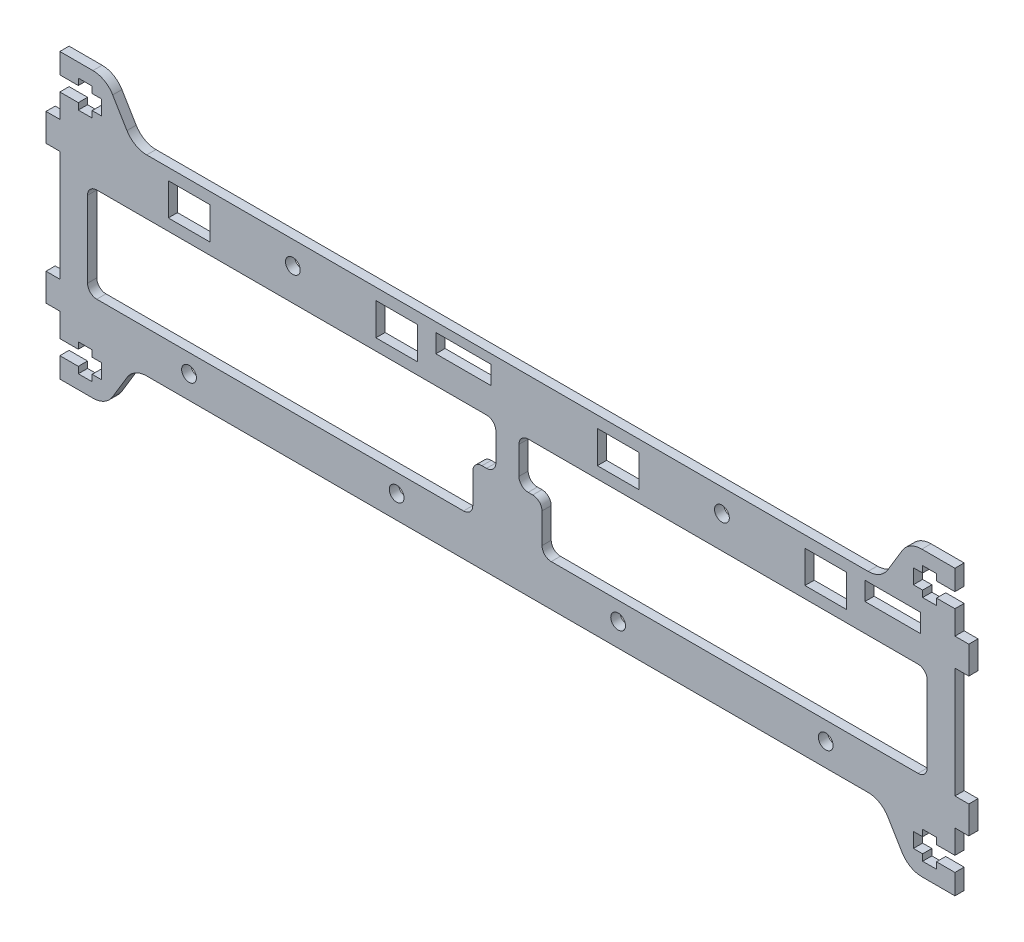
from build123d import *

# Parameters (mm, degrees)
SKETCH_1_R          = 1.6
SKETCH_1_W          = 83.5
SKETCH_1_H          = 20.5
EXTRUDE_1_DEPTH     = 2
SKETCH_3_W          = 5
SKETCH_3_H          = 10
CUT_EXTRUDE_2_DEPTH = 101.127730924
SKETCH_4_W          = 9
SKETCH_4_H          = 7
SKETCH_4_W_2        = 23
SKETCH_4_H_2        = 5.5
SKETCH_4_W_3        = 38
CUT_EXTRUDE_3_DEPTH = 101.127730924
SKETCH_5_W          = 12
SKETCH_5_H          = 4
CUT_EXTRUDE_4_DEPTH = 101.127730924
FILLET_8_R          = 2
FILLET_9_R          = 2
SKETCH_7_W          = 10
SKETCH_7_H          = 10
EXTRUDE_3_DEPTH     = 2
SKETCH_9_W          = 162.568913239
SKETCH_9_H          = 21.283892233
CUT_EXTRUDE_5_DEPTH = 103.240219581
SKETCH_8_W          = 3
SKETCH_8_H          = 6
EXTRUDE_4_DEPTH     = 2
CUT_EXTRUDE_6_DEPTH = 106.090734606
FILLET_10_R         = 5


with BuildPart() as part:
    # 草图1 → 凸台-拉伸1 (new body)
    with BuildSketch(Plane.XY):
        Polygon((64, -19.25), (29, -19.25), (29, -24.75), (-29, -24.75), (-29, -19.25), (-64, -19.25), (-64, -24.75), (-97, -24.75), (-97, 22.25), (97, 22.25), (97, -24.75), (64, -24.75), align=None)
        with Locations((-46.5, 17.25)):
            Circle(SKETCH_1_R, mode=Mode.SUBTRACT)
        with Locations((-69, -14.25)):
            Circle(SKETCH_1_R, mode=Mode.SUBTRACT)
        with Locations((-24, -14.25)):
            Circle(SKETCH_1_R, mode=Mode.SUBTRACT)
        with Locations(Location((69, -14.25, 0), (0, 0, 180))):
            Circle(SKETCH_1_R, mode=Mode.SUBTRACT)
        with Locations(Location((46.5, 17.25, 0), (0, 0, 180))):
            Circle(SKETCH_1_R, mode=Mode.SUBTRACT)
        with Locations(Location((24, -14.25, 0), (0, 0, 180))):
            Circle(SKETCH_1_R, mode=Mode.SUBTRACT)
        with Locations((-69, -21.75)):
            Circle(SKETCH_1_R, mode=Mode.SUBTRACT)
        with Locations((-24, -21.75)):
            Circle(SKETCH_1_R, mode=Mode.SUBTRACT)
        with Locations((24, -21.75)):
            Circle(SKETCH_1_R, mode=Mode.SUBTRACT)
        with Locations((69, -21.75)):
            Circle(SKETCH_1_R, mode=Mode.SUBTRACT)
        with Locations((-49.25, 0)):
            Rectangle(SKETCH_1_W, SKETCH_1_H, mode=Mode.SUBTRACT)
        with Locations((49.25, 0)):
            Rectangle(SKETCH_1_W, SKETCH_1_H, mode=Mode.SUBTRACT)
    extrude(amount=EXTRUDE_1_DEPTH)

    # 草图3 → 切除-拉伸2 (cut, through all)
    with BuildSketch(Plane.XY.offset(2)):
        with Locations((-5, 5.25)):
            Rectangle(SKETCH_3_W, SKETCH_3_H)
        with Locations((5, 5.25)):
            Rectangle(SKETCH_3_W, SKETCH_3_H)
    extrude(amount=-CUT_EXTRUDE_2_DEPTH, mode=Mode.SUBTRACT)

    # 草图4 → 切除-拉伸3 (cut, through all)
    with BuildSketch(Plane(origin=(0, 0, 0), x_dir=(-1, 0, 0), z_dir=(0, 0, -1))):
        with Locations((-69, 16.25)):
            Rectangle(SKETCH_4_W, SKETCH_4_H)
        with Locations((-24, 16.25)):
            Rectangle(SKETCH_4_W, SKETCH_4_H)
        with Locations((24, 16.25)):
            Rectangle(SKETCH_4_W, SKETCH_4_H)
        with Locations((69, 16.25)):
            Rectangle(SKETCH_4_W, SKETCH_4_H)
        with Locations((-85.5, -22)):
            Rectangle(SKETCH_4_W_2, SKETCH_4_H_2)
        with Locations((85.5, -22)):
            Rectangle(SKETCH_4_W_2, SKETCH_4_H_2)
        with Locations((0, -22)):
            Rectangle(SKETCH_4_W_3, SKETCH_4_H_2)
    extrude(amount=-CUT_EXTRUDE_3_DEPTH, mode=Mode.SUBTRACT)

    # 草图5 → 切除-拉伸4 (cut, through all)
    with BuildSketch(Plane(origin=(0, 0, 0), x_dir=(-1, 0, 0), z_dir=(0, 0, -1))):
        with Locations((-83.5, 18.25)):
            Rectangle(SKETCH_5_W, SKETCH_5_H)
        with Locations((9.5, 18.25)):
            Rectangle(SKETCH_5_W, SKETCH_5_H)
    extrude(amount=-CUT_EXTRUDE_4_DEPTH, mode=Mode.SUBTRACT)

    # 圆角8
    fillet_8_edges = [part.edges().sort_by_distance(p)[0] for p in [
        (-7.5, 0.25, 1),
        (-2.5, 10.25, 1),
        (-2.5, 0.25, 1),
        (7.5, 0.25, 1),
        (2.5, 0.25, 1),
        (2.5, 10.25, 1),
        (-91, 10.25, 1),
        (-91, -10.25, 1),
        (-7.5, -10.25, 1),
        (7.5, -10.25, 1),
        (91, -10.25, 1),
        (91, 10.25, 1),
    ]]
    fillet(fillet_8_edges, radius=FILLET_8_R)

    # 圆角9
    fillet_9_edges = [part.edges().sort_by_distance(p)[0] for p in [
        (74, -19.25, 1),
        (74, -24.75, 1),
        (-74, -24.75, 1),
        (-74, -19.25, 1),
        (19, -24.75, 1),
        (19, -19.25, 1),
        (64, -24.75, 1),
        (-19, -19.25, 1),
        (-19, -24.75, 1),
        (64, -19.25, 1),
        (29, -19.25, 1),
        (29, -24.75, 1),
        (-29, -24.75, 1),
        (-29, -19.25, 1),
        (-64, -19.25, 1),
        (-64, -24.75, 1),
    ]]
    fillet(fillet_9_edges, radius=FILLET_9_R)

    # 草图7 → 凸台-拉伸3 (add)
    with BuildSketch(Plane(origin=(0, 0, 0), x_dir=(-1, 0, 0), z_dir=(0, 0, -1))):
        with Locations((-92, 27.25)):
            Rectangle(SKETCH_7_W, SKETCH_7_H)
        with Locations((-92, -24.25)):
            Rectangle(SKETCH_7_W, SKETCH_7_H)
        with Locations((92, 27.25)):
            Rectangle(SKETCH_7_W, SKETCH_7_H)
        with Locations((92, -24.25)):
            Rectangle(SKETCH_7_W, SKETCH_7_H)
    extrude(amount=-EXTRUDE_3_DEPTH)

    # 草图9 → 切除-拉伸5 (cut, through all)
    with BuildSketch(Plane(origin=(0, 0, 0), x_dir=(-1, 0, 0), z_dir=(0, 0, -1))):
        with Locations((0.619782194, -29.891946117)):
            Rectangle(SKETCH_9_W, SKETCH_9_H)
    extrude(amount=-CUT_EXTRUDE_5_DEPTH, mode=Mode.SUBTRACT)

    # 草图8 → 凸台-拉伸4 (add)
    with BuildSketch(Plane(origin=(0, 0, 0), x_dir=(-1, 0, 0), z_dir=(0, 0, -1))):
        Polygon((-87, 32.25), (-81, 22.25), (-87, 22.25), align=None)
        Polygon((87, 32.25), (81, 22.25), (87, 22.25), align=None)
        Polygon((-87, -29.25), (-81, -19.25), (-87, -19.25), align=None)
        Polygon((87, -29.25), (81, -19.25), (87, -19.25), align=None)
        with Locations((-98.5, 16.5)):
            Rectangle(SKETCH_8_W, SKETCH_8_H)
        with Locations((-98.5, -13.5)):
            Rectangle(SKETCH_8_W, SKETCH_8_H)
        with Locations((98.5, -13.5)):
            Rectangle(SKETCH_8_W, SKETCH_8_H)
        with Locations((98.5, 16.5)):
            Rectangle(SKETCH_8_W, SKETCH_8_H)
    extrude(amount=-EXTRUDE_4_DEPTH)

    # 草图10 → 切除-拉伸6 (cut, through all)
    with BuildSketch(Plane(origin=(0, 0, 0), x_dir=(-1, 0, 0), z_dir=(0, 0, -1))):
        Polygon((-97, 27.85), (-93, 27.85), (-93, 29.25), (-90, 29.25), (-90, 27.85), (-88, 27.85), (-88, 24.65), (-90, 24.65), (-90, 23.25), (-93, 23.25), (-93, 24.65), (-97, 24.65), align=None)
        Polygon((-97, -24.85), (-93, -24.85), (-93, -26.25), (-90, -26.25), (-90, -24.85), (-88, -24.85), (-88, -21.65), (-90, -21.65), (-90, -20.25), (-93, -20.25), (-93, -21.65), (-97, -21.65), align=None)
        Polygon((97, -24.85), (97, -21.65), (93, -21.65), (93, -20.25), (90, -20.25), (90, -21.65), (88, -21.65), (88, -24.85), (90, -24.85), (90, -26.25), (93, -26.25), (93, -24.85), align=None)
        Polygon((97, 27.85), (93, 27.85), (93, 29.25), (90, 29.25), (90, 27.85), (88, 27.85), (88, 24.65), (90, 24.65), (90, 23.25), (93, 23.25), (93, 24.65), (97, 24.65), align=None)
    extrude(amount=-CUT_EXTRUDE_6_DEPTH, mode=Mode.SUBTRACT)

    # 圆角10
    fillet_10_edges = [part.edges().sort_by_distance(p)[0] for p in [
        (87, 32.25, 1),
        (87, -29.25, 1),
        (-87, 32.25, 1),
        (-87, -29.25, 1),
        (81, 22.25, 1),
        (-81, 22.25, 1),
        (81, -19.25, 1),
        (-81, -19.25, 1),
    ]]
    fillet(fillet_10_edges, radius=FILLET_10_R)


solid = part.part
